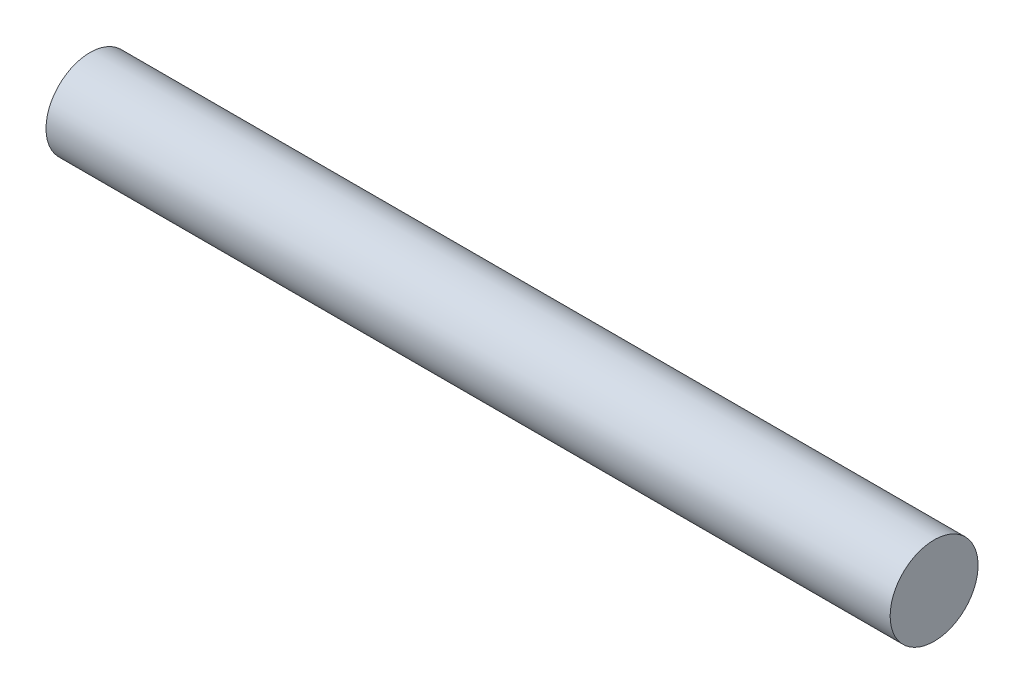
from build123d import *

# Parameters (mm, degrees)
SKETCH2_R           = 15.875
BOSS_EXTRUDE1_DEPTH = 76.2
SKETCH3_R           = 15.875
BOSS_EXTRUDE2_DEPTH = 228.6


with BuildPart() as part:
    # Sketch2 → Boss-Extrude1 (new body)
    with BuildSketch(Plane(origin=(0, 0, 0), x_dir=(0, 0, -1), z_dir=(1, 0, 0))):
        with Locations(Location((0, 0, 0), (0, 0, 180))):
            Circle(SKETCH2_R)
    extrude(amount=BOSS_EXTRUDE1_DEPTH)

    # Sketch3 → Boss-Extrude2 (add)
    with BuildSketch(Plane(origin=(76.2, 0, 0), x_dir=(0, 0, -1), z_dir=(1, 0, 0))):
        with Locations(Location((0, 0, 0), (0, 0, 180))):
            Circle(SKETCH3_R)
    extrude(amount=BOSS_EXTRUDE2_DEPTH)


solid = part.part
